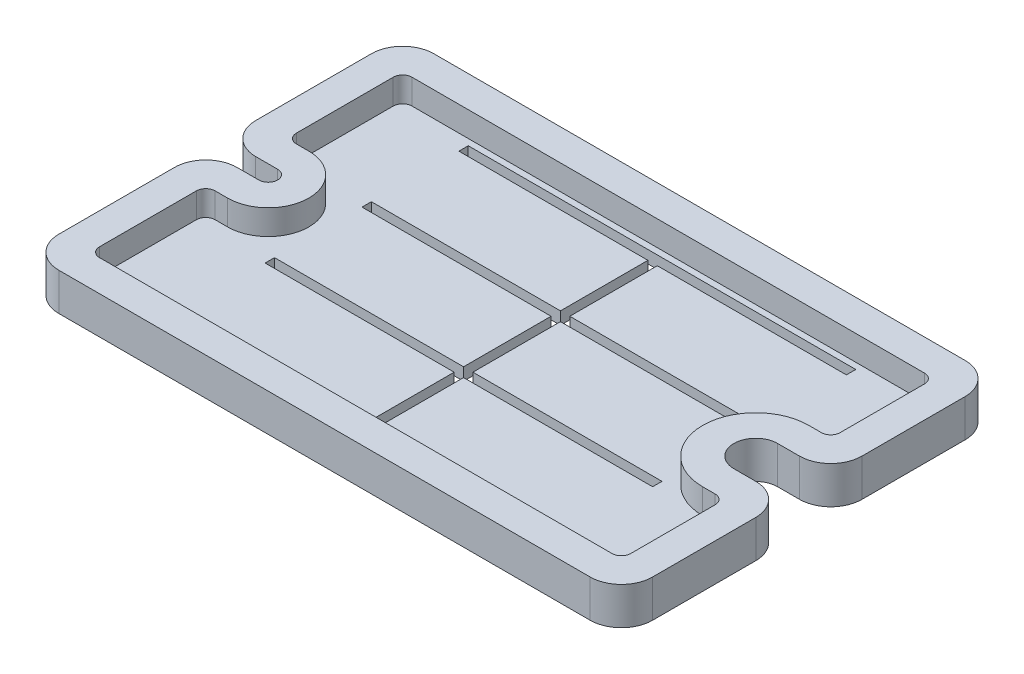
from build123d import *

# Parameters (mm, degrees)
SKETCH1_W           = 95
SKETCH1_H           = 60
BOSS_EXTRUDE1_DEPTH = 6
SKETCH6_R           = 3.5
SKETCH6_R_2         = 1.5
CUT_EXTRUDE3_DEPTH  = 113.521109131
CUT_EXTRUDE1_DEPTH  = 4
CUT_EXTRUDE2_DEPTH  = 113.521109131
FILLET3_R           = 1.5
SKETCH7_W           = 8.5
SKETCH7_H           = 3
SKETCH7_H_2         = 7
CUT_EXTRUDE4_DEPTH  = 113.521109131
FILLET4_R           = 5
FILLET5_R           = 1.5


with BuildPart() as part:
    # Sketch1 → Boss-Extrude1 (new body)
    with BuildSketch(Plane(origin=(0, 0, 0), x_dir=(1, 0, 0), z_dir=(0, 1, 0))):
        with Locations((47.5, 30)):
            Rectangle(SKETCH1_W, SKETCH1_H)
    extrude(amount=BOSS_EXTRUDE1_DEPTH)

    # Sketch6 → Cut-Extrude3 (cut, through all)
    with BuildSketch(Plane.XZ):
        with Locations(Location((86.5, -30, 0), (0, 0, 270))):
            Circle(SKETCH6_R)
        with Locations(Location((8.5, -30, 0), (0, 0, 270))):
            Circle(SKETCH6_R_2)
    extrude(amount=-CUT_EXTRUDE3_DEPTH, mode=Mode.SUBTRACT)

    # Sketch2 → Cut-Extrude1 (cut)
    with BuildSketch(Plane(origin=(0, 6, 0), x_dir=(-1, 0, 0), z_dir=(0, 1, 0))):
        with BuildLine():
            Line((-8.5, -36.5), (-5, -36.5))
            Line((-5, -36.5), (-5, -55))
            Line((-5, -55), (-90, -55))
            Line((-90, -55), (-90, -38.5))
            Line((-90, -38.5), (-86.5, -38.5))
            ThreePointArc((-86.5, -38.5), (-78, -30), (-86.5, -21.5))
            Line((-86.5, -21.5), (-90, -21.5))
            Line((-90, -21.5), (-90, -5))
            Line((-90, -5), (-5, -5))
            Line((-5, -5), (-5, -23.5))
            Line((-5, -23.5), (-8.5, -23.5))
            ThreePointArc((-8.5, -23.5), (-15, -30), (-8.5, -36.5))
        make_face()
    extrude(amount=-CUT_EXTRUDE1_DEPTH, mode=Mode.SUBTRACT)

    # Sketch5 → Cut-Extrude2 (cut, through all)
    with BuildSketch(Plane.XZ):
        Polygon((46.75, -37), (46.75, -23), (16.5, -23), (16.5, -21.5), (46.75, -21.5), (46.75, -7.5), (16.5, -7.5), (16.5, -6), (47.5, -6), (78.5, -6), (78.5, -7.5), (48.25, -7.5), (48.25, -21.5), (78.5, -21.5), (78.5, -23), (48.25, -23), (48.25, -37), (78.5, -37), (78.5, -38.5), (48.25, -38.5), (48.25, -52.5), (78.5, -52.5), (78.5, -54), (47.5, -54), (16.5, -54), (16.5, -52.5), (46.75, -52.5), (46.75, -38.5), (16.5, -38.5), (16.5, -37), align=None)
    extrude(amount=-CUT_EXTRUDE2_DEPTH, mode=Mode.SUBTRACT)

    # Fillet3
    fillet3_edges = [part.edges().sort_by_distance(p)[0] for p in [
        (90, 4, -55),
    ]]
    fillet(fillet3_edges, radius=FILLET3_R)

    # Sketch7 → Cut-Extrude4 (cut, through all)
    with BuildSketch(Plane(origin=(0, 6, 0), x_dir=(-1, 0, 0), z_dir=(0, 1, 0))):
        with Locations((-4.25, -30)):
            Rectangle(SKETCH7_W, SKETCH7_H)
        with Locations((-90.75, -30)):
            Rectangle(SKETCH7_W, SKETCH7_H_2)
    extrude(amount=-CUT_EXTRUDE4_DEPTH, mode=Mode.SUBTRACT)

    # Fillet4
    fillet4_edges = [part.edges().sort_by_distance(p)[0] for p in [
        (0, 3, -28.5),
        (0, 3, -31.5),
        (95, 3, -33.5),
        (95, 3, -26.5),
        (0, 3, -60),
        (95, 3, -60),
        (95, 3, 0),
        (0, 3, 0),
    ]]
    fillet(fillet4_edges, radius=FILLET4_R)

    # Fillet5
    fillet5_edges = [part.edges().sort_by_distance(p)[0] for p in [
        (5, 4, -5),
        (5, 4, -23.5),
        (5, 4, -36.5),
        (5, 4, -55),
        (90, 4, -38.5),
        (90, 4, -21.5),
        (90, 4, -5),
    ]]
    fillet(fillet5_edges, radius=FILLET5_R)


solid = part.part
